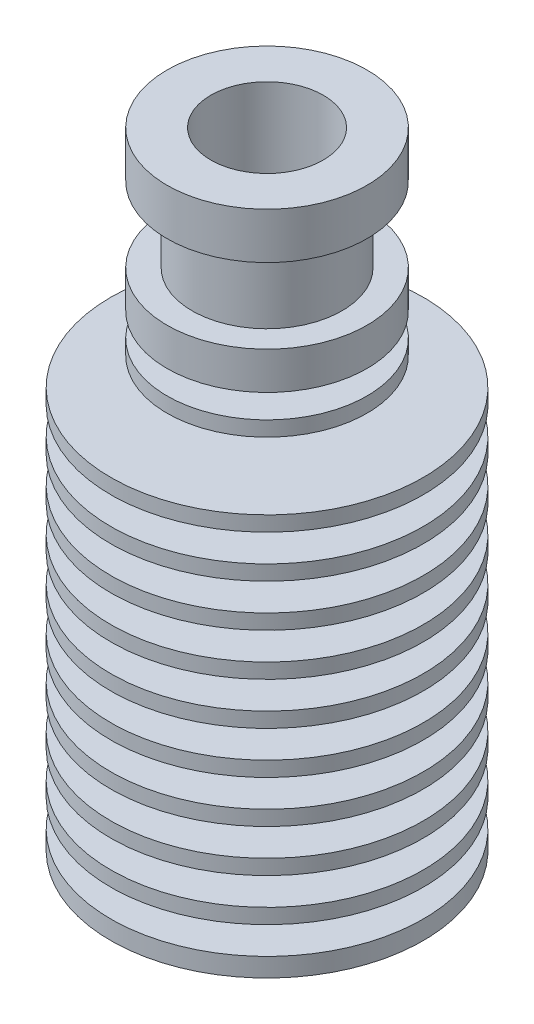
from build123d import *


with BuildPart() as part:
    # Skica1 → Rotovat1 (revolve)
    with BuildSketch(Plane.XY, mode=Mode.PRIVATE) as rotovat1_sk:
        Polygon((8, 64.637455621), (4.5, 64.637455621), (4.5, 52.97460351), (2, 50.637455621), (2, 46.936179321), (2, 31.837455621), (3, 31.837455621), (3, 14.537455621), (12.5, 14.537455621), (12.5, 16.037455621), (7.5, 16.037455621), (7.5, 18.237455621), (12.5, 18.237455621), (12.5, 19.437455621), (7.5, 19.437455621), (7.5, 21.637455621), (12.5, 21.637455621), (12.5, 22.837455621), (7.5, 22.837455621), (7.5, 25.037455621), (12.5, 25.037455621), (12.5, 26.237455621), (7.5, 26.237455621), (7.5, 28.437455621), (12.5, 28.437455621), (12.5, 29.637455621), (7.5, 29.637455621), (7.5, 31.837455621), (12.5, 31.837455621), (12.5, 33.037455621), (6.5, 33.037455621), (6.5, 35.237455621), (12.5, 35.237455621), (12.5, 36.437455621), (4, 36.437455621), (4, 38.637455621), (12.5, 38.637455621), (12.5, 39.837455621), (4, 39.837455621), (4, 42.037455621), (12.5, 42.037455621), (12.5, 43.237455621), (4, 43.237455621), (4, 45.437455621), (12.5, 45.437455621), (12.5, 46.637455621), (4, 46.637455621), (4, 48.837455621), (8, 48.837455621), (8, 50.037455621), (4.5, 50.037455621), (4.5, 51.937455621), (8, 51.937455621), (8, 54.937455621), (6, 54.937455621), (6, 60.937455621), (8, 60.937455621), align=None)
    revolve(rotovat1_sk.sketch.rotate(Axis((0, 64.637455621, 0), (0, -1, 0)), 180), axis=Axis((0, 64.637455621, 0), (0, -1, 0)))


solid = part.part
